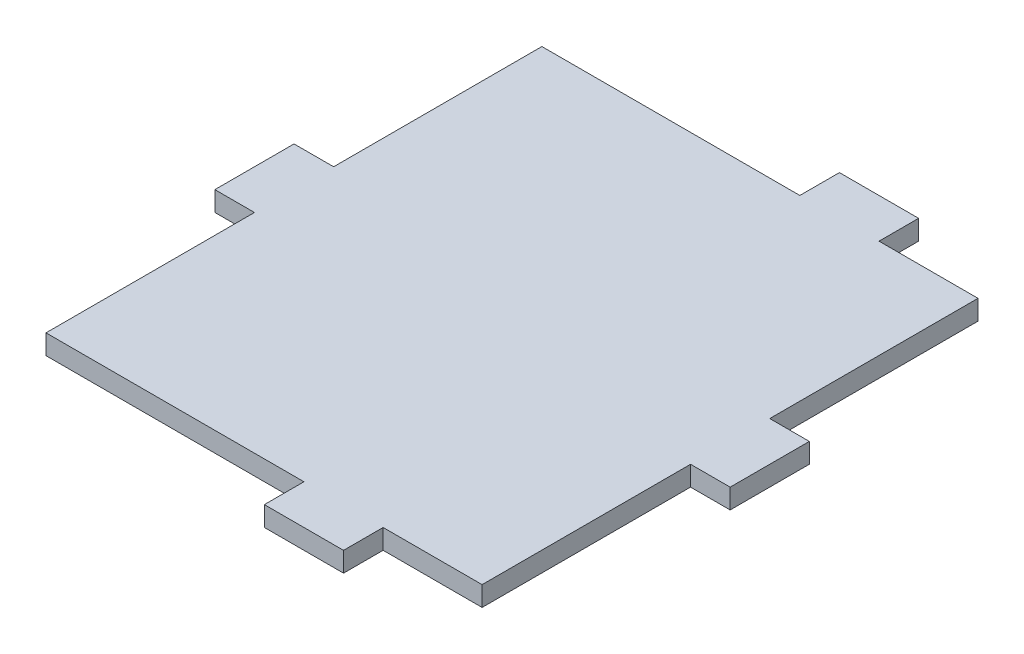
from build123d import *

# Parameters (mm, degrees)
BOSS_EXTRUDE1_DEPTH = 1


with BuildPart() as part:
    # Sketch1 → Boss-Extrude1 (new body)
    with BuildSketch(Plane(origin=(0, 0, 0), x_dir=(1, 0, 0), z_dir=(0, 1, 0))):
        Polygon((26.03, 12.53), (24.03, 12.53), (24.03, 2), (19.03, 2), (19.03, 0), (15.03, 0), (15.03, 2), (2, 2), (2, 12.53), (0, 12.53), (0, 16.53), (2, 16.53), (2, 27.05), (15.03, 27.05), (15.03, 29.05), (19.03, 29.05), (19.03, 27.05), (24.03, 27.05), (24.03, 16.53), (26.03, 16.53), align=None)
    extrude(amount=BOSS_EXTRUDE1_DEPTH)


solid = part.part
